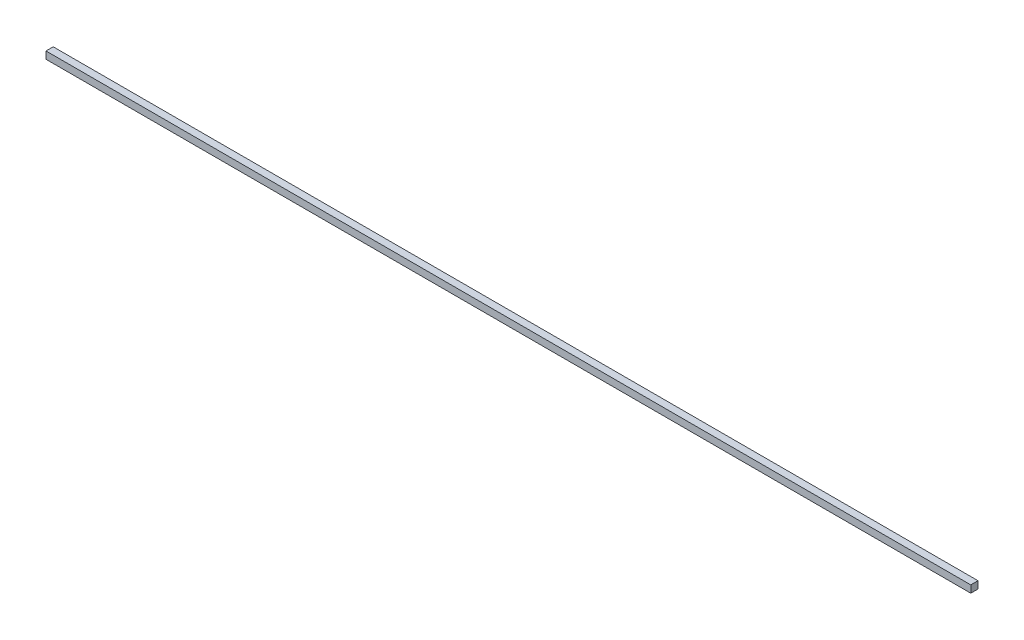
from build123d import *

# Parameters (mm, degrees)
SKETCH1_W           = 6.35
SKETCH1_H           = 6.35
BOSS_EXTRUDE1_DEPTH = 812.8


with BuildPart() as part:
    # Sketch1 → Boss-Extrude1 (new body)
    with BuildSketch(Plane(origin=(0, 0, 0), x_dir=(0, 0, -1), z_dir=(1, 0, 0))):
        with Locations((3.175, 3.175)):
            Rectangle(SKETCH1_W, SKETCH1_H)
    extrude(amount=BOSS_EXTRUDE1_DEPTH)


solid = part.part
